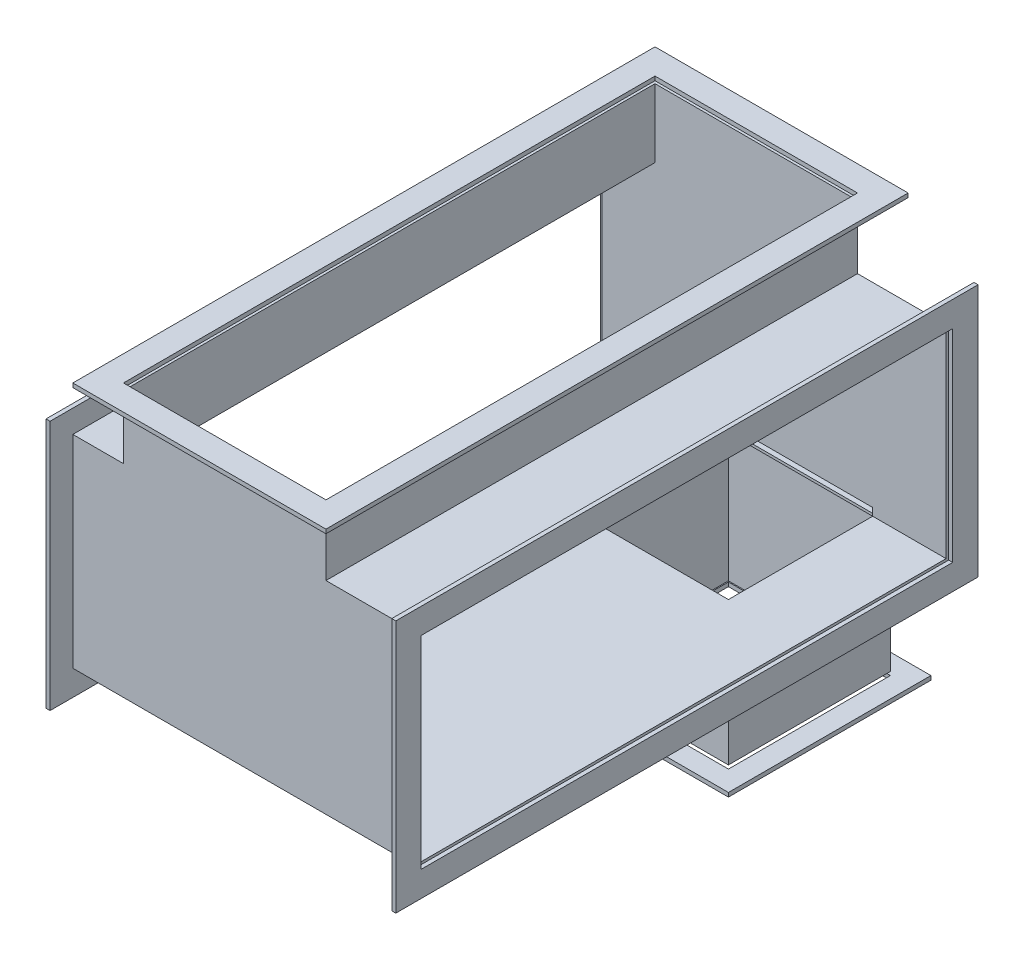
from build123d import *

# Parameters (mm, degrees)
BOSS_EXTRUDE1_DEPTH     = 1050
SKETCH4_W               = 320
SKETCH4_H               = 320
BOSS_EXTRUDE2_DEPTH     = 280
SKETCH5_W               = 1150
SKETCH5_H               = 500
SKETCH5_W_2             = 1050
SKETCH5_H_2             = 400
BOSS_EXTRUDE3_DEPTH     = 8
SKETCH6_W               = 1040
SKETCH6_H               = 390
CUT_EXTRUDE1_DEPTH      = 690
SKETCH7_W               = 500
SKETCH7_H               = 1150
SKETCH7_W_2             = 400
SKETCH7_H_2             = 1050
BOSS_EXTRUDE4_DEPTH     = 8
SKETCH11_W              = 1145
SKETCH11_H              = 495
SKETCH11_W_2            = 1045
SKETCH11_H_2            = 395
BOSS_EXTRUDE8_DEPTH     = 8
SKETCH12_W              = 390
SKETCH12_H              = 1040
CUT_EXTRUDE4_DEPTH      = 300
CUT_EXTRUDE5_DEPTH      = 1425.664170954
CUT_EXTRUDE5_DEPTH_BACK = 300
SKETCH14_W              = 310
SKETCH14_H              = 310
SKETCH15_W              = 400
SKETCH15_H              = 400
BOSS_EXTRUDE9_DEPTH     = 8
SKETCH17_W              = 680
SKETCH17_H              = 40
BOSS_EXTRUDE13_DEPTH    = 5
SKETCH18_W              = 320
SKETCH18_H              = 320
CUT_EXTRUDE6_DEPTH      = 15


with BuildPart() as part:
    # Sketch2 → Boss-Extrude1 (new body)
    with BuildSketch(Plane.XY):
        Polygon((200, 200), (380, 200), (380, -200), (200, -200), (-200, -200), (-300, -200), (-300, 200), (-200, 200), (-200, 330), (200, 330), align=None)
    extrude(amount=BOSS_EXTRUDE1_DEPTH)

    # Sketch4 → Boss-Extrude2 (add)
    with BuildSketch(Plane.XZ.offset(200)):
        with Locations((80, 135)):
            Rectangle(SKETCH4_W, SKETCH4_H)
    extrude(amount=BOSS_EXTRUDE2_DEPTH)

    # Sketch6 → Cut-Extrude1 (cut)
    with BuildSketch(Plane(origin=(380, 0, 0), x_dir=(0, 0, -1), z_dir=(1, 0, 0))):
        with Locations((-525, 0)):
            Rectangle(SKETCH6_W, SKETCH6_H)
    extrude(amount=-CUT_EXTRUDE1_DEPTH, mode=Mode.SUBTRACT)

    # Sketch12 → Cut-Extrude4 (cut)
    with BuildSketch(Plane(origin=(0, 330, 0), x_dir=(1, 0, 0), z_dir=(0, 1, 0))):
        with Locations((0, -525)):
            Rectangle(SKETCH12_W, SKETCH12_H)
    extrude(amount=-CUT_EXTRUDE4_DEPTH, mode=Mode.SUBTRACT)

    # Sketch14 → Cut-Extrude5 (cut, two sides: drawn at the far end of the back side and taken through both)
    with BuildSketch(Plane(origin=(0, -480, 0), x_dir=(-1, 0, 0), z_dir=(0, -1, 0)).offset(-CUT_EXTRUDE5_DEPTH_BACK)):
        with Locations((-80, -135)):
            Rectangle(SKETCH14_W, SKETCH14_H)
    extrude(amount=CUT_EXTRUDE5_DEPTH + CUT_EXTRUDE5_DEPTH_BACK, mode=Mode.SUBTRACT)

    # Sketch15 → Boss-Extrude9 (add)
    with BuildSketch(Plane(origin=(0, -480, 0), x_dir=(-1, 0, 0), z_dir=(0, -1, 0))):
        with Locations((-80, -135)):
            Rectangle(SKETCH15_W, SKETCH15_H)
    extrude(amount=BOSS_EXTRUDE9_DEPTH)

    # Sketch18 → Cut-Extrude6 (cut)
    with BuildSketch(Plane.XZ.offset(488)):
        with Locations((80, 135)):
            Rectangle(SKETCH18_W, SKETCH18_H)
    extrude(amount=-CUT_EXTRUDE6_DEPTH, mode=Mode.SUBTRACT)


with BuildPart() as body_2:
    # Sketch5 → Boss-Extrude3 (new body)
    with BuildSketch(Plane(origin=(380, 0, 0), x_dir=(0, 0, -1), z_dir=(1, 0, 0))):
        with Locations((-525, 0)):
            Rectangle(SKETCH5_W, SKETCH5_H)
        with Locations((-525, 0)):
            Rectangle(SKETCH5_W_2, SKETCH5_H_2, mode=Mode.SUBTRACT)
    extrude(amount=BOSS_EXTRUDE3_DEPTH)


with BuildPart() as body_3:
    # Sketch7 → Boss-Extrude4 (new body)
    with BuildSketch(Plane(origin=(0, 330, 0), x_dir=(1, 0, 0), z_dir=(0, 1, 0))):
        with Locations((0, -525)):
            Rectangle(SKETCH7_W, SKETCH7_H)
        with Locations((0, -525)):
            Rectangle(SKETCH7_W_2, SKETCH7_H_2, mode=Mode.SUBTRACT)
    extrude(amount=BOSS_EXTRUDE4_DEPTH)


with BuildPart() as body_4:
    # Sketch11 → Boss-Extrude8 (new body)
    with BuildSketch(Plane.ZY.offset(300)):
        with Locations((522.5, -2.5)):
            Rectangle(SKETCH11_W, SKETCH11_H)
        with Locations((522.5, 2.5)):
            Rectangle(SKETCH11_W_2, SKETCH11_H_2, mode=Mode.SUBTRACT)
    extrude(amount=BOSS_EXTRUDE8_DEPTH)


with BuildPart() as body_5:
    # Sketch17 → Boss-Extrude13 (new body)
    with BuildSketch(Plane(origin=(0, -200, 0), x_dir=(1, 0, 0), z_dir=(0, 1, 0))):
        with Locations((40, 20)):
            Rectangle(SKETCH17_W, SKETCH17_H)
    extrude(amount=BOSS_EXTRUDE13_DEPTH)


with BuildPart() as cut_extrude6_piece_1:
    # of the separate pieces the step leaves, piece 1, a body of its own (cut_extrude6_pieces)
    add(part.part.solids().sort_by_distance((-80, -200, -25))[0])


with BuildPart() as cut_extrude6_piece_2:
    # of the separate pieces the step leaves, piece 2, a body of its own (cut_extrude6_pieces)
    add(part.part.solids().sort_by_distance((-120, -480, 335))[0])


solid = Compound([body_2.part, body_3.part, body_4.part, body_5.part, cut_extrude6_piece_1.part, cut_extrude6_piece_2.part])
